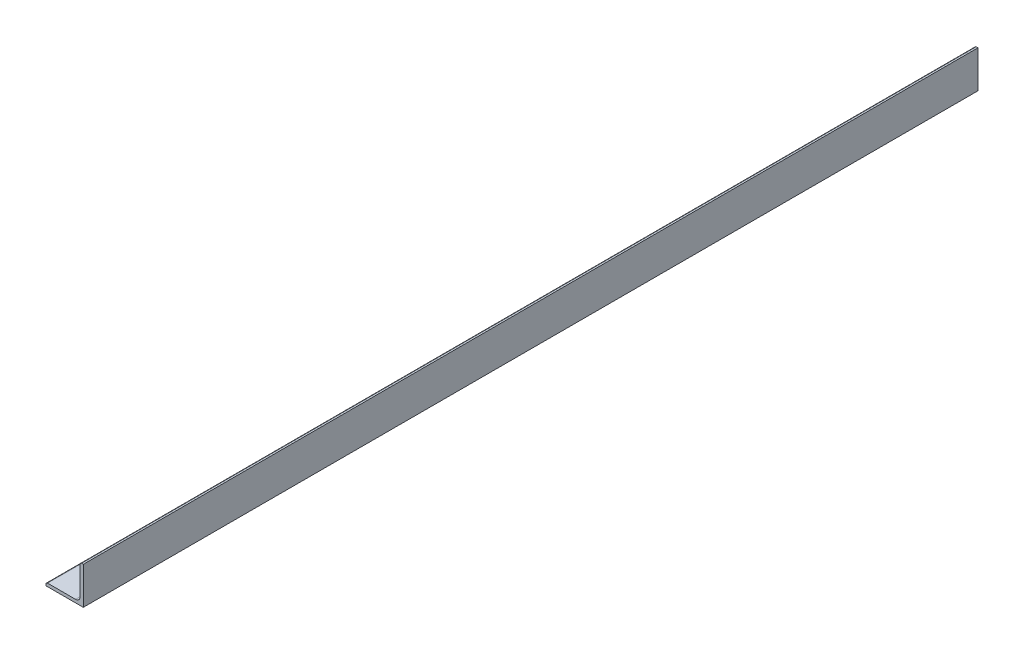
from build123d import *

# Parameters (mm, degrees)
BOSS_EXTRUDE1_DEPTH = 457.2


with BuildPart() as part:
    # Sketch2 → Boss-Extrude1 (new, symmetric)
    with BuildSketch(Plane.XY):
        with BuildLine():
            Line((-19.05, -19.05), (19.05, -19.05))
            Line((19.05, -19.05), (19.05, 19.05))
            Line((19.05, 19.05), (17.4625, 19.05))
            ThreePointArc((17.4625, 19.05), (16.339967985, 18.585032015), (15.875, 17.4625))
            Line((15.875, 17.4625), (15.875, -11.0998))
            ThreePointArc((15.875, -11.0998), (14.476376302, -14.476376302), (11.0998, -15.875))
            Line((11.0998, -15.875), (-17.4625, -15.875))
            ThreePointArc((-17.4625, -15.875), (-18.585032015, -16.339967985), (-19.05, -17.4625))
            Line((-19.05, -17.4625), (-19.05, -19.05))
        make_face()
    extrude(amount=BOSS_EXTRUDE1_DEPTH, both=True)


solid = part.part
